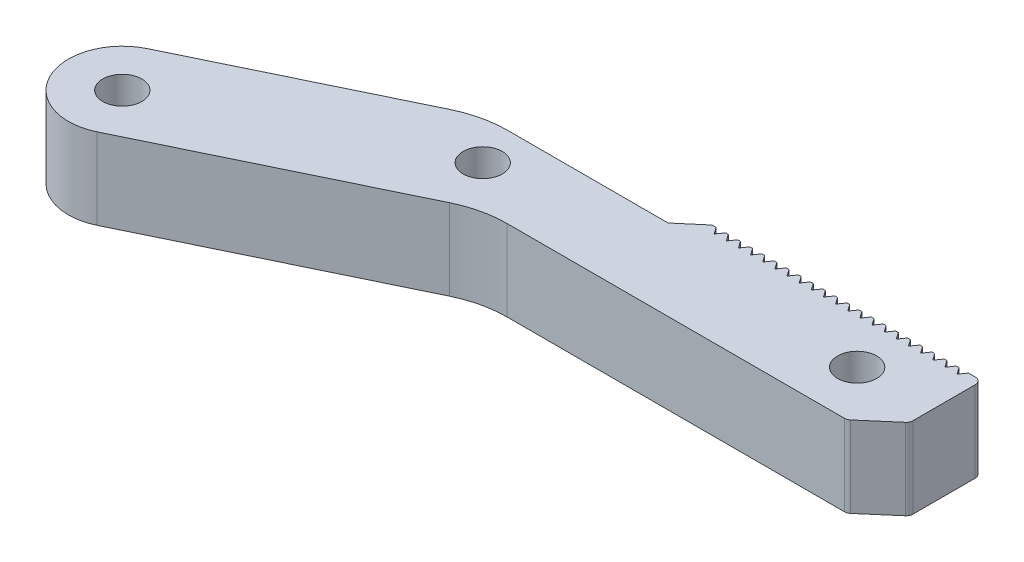
from build123d import *

# Parameters (mm, degrees)
CROQUIS1_R              = 1.45
SALIENTE_EXTRUIR1_DEPTH = 6
REDONDEO1_R             = 0.5
REDONDEO2_R             = 8


with BuildPart() as part:
    # Croquis1 → Saliente-Extruir1 (new body)
    with BuildSketch(Plane(origin=(0, 0, 0), x_dir=(1, 0, 0), z_dir=(0, 1, 0))):
        with BuildLine():
            Line((-2.262086681, -28.652334501), (24.75319, -28.652334501))
            Line((24.75319, -28.652334501), (27.25319, -26.502334501))
            Line((27.25319, -26.502334501), (27.25319, -22.652334501))
            Line((27.25319, -22.652334501), (27.25319, -21.152334501))
            Line((27.25319, -21.152334501), (26.25319, -21.152334501))
            Line((26.25319, -21.152334501), (25.90319, -21.652334501))
            Line((25.90319, -21.652334501), (25.55319, -21.152334501))
            Line((25.55319, -21.152334501), (25.35319, -21.152334501))
            Line((25.35319, -21.152334501), (25.00319, -21.652334501))
            Line((25.00319, -21.652334501), (24.65319, -21.152334501))
            Line((24.65319, -21.152334501), (24.45319, -21.152334501))
            Line((24.45319, -21.152334501), (24.10319, -21.652334501))
            Line((24.10319, -21.652334501), (23.75319, -21.152334501))
            Line((23.75319, -21.152334501), (23.55319, -21.152334501))
            Line((23.55319, -21.152334501), (23.20319, -21.652334501))
            Line((23.20319, -21.652334501), (22.85319, -21.152334501))
            Line((22.85319, -21.152334501), (22.65319, -21.152334501))
            Line((22.65319, -21.152334501), (22.30319, -21.652334501))
            Line((22.30319, -21.652334501), (21.95319, -21.152334501))
            Line((21.95319, -21.152334501), (21.75319, -21.152334501))
            Line((21.75319, -21.152334501), (21.40319, -21.652334501))
            Line((21.40319, -21.652334501), (21.05319, -21.152334501))
            Line((21.05319, -21.152334501), (20.85319, -21.152334501))
            Line((20.85319, -21.152334501), (20.50319, -21.652334501))
            Line((20.50319, -21.652334501), (20.15319, -21.152334501))
            Line((20.15319, -21.152334501), (19.95319, -21.152334501))
            Line((19.95319, -21.152334501), (19.60319, -21.652334501))
            Line((19.60319, -21.652334501), (19.25319, -21.152334501))
            Line((19.25319, -21.152334501), (19.05319, -21.152334501))
            Line((19.05319, -21.152334501), (18.70319, -21.652334501))
            Line((18.70319, -21.652334501), (18.35319, -21.152334501))
            Line((18.35319, -21.152334501), (18.15319, -21.152334501))
            Line((18.15319, -21.152334501), (17.80319, -21.652334501))
            Line((17.80319, -21.652334501), (17.45319, -21.152334501))
            Line((17.45319, -21.152334501), (17.25319, -21.152334501))
            Line((17.25319, -21.152334501), (16.90319, -21.652334501))
            Line((16.90319, -21.652334501), (16.55319, -21.152334501))
            Line((16.55319, -21.152334501), (16.35319, -21.152334501))
            Line((16.35319, -21.152334501), (16.00319, -21.652334501))
            Line((16.00319, -21.652334501), (15.65319, -21.152334501))
            Line((15.65319, -21.152334501), (15.45319, -21.152334501))
            Line((15.45319, -21.152334501), (15.10319, -21.652334501))
            Line((15.10319, -21.652334501), (14.75319, -21.152334501))
            Line((14.75319, -21.152334501), (14.55319, -21.152334501))
            Line((14.55319, -21.152334501), (14.20319, -21.652334501))
            Line((14.20319, -21.652334501), (13.85319, -21.152334501))
            Line((13.85319, -21.152334501), (13.65319, -21.152334501))
            Line((13.65319, -21.152334501), (13.30319, -21.652334501))
            Line((13.30319, -21.652334501), (12.95319, -21.152334501))
            Line((12.95319, -21.152334501), (12.75319, -21.152334501))
            Line((12.75319, -21.152334501), (12.40319, -21.652334501))
            Line((12.40319, -21.652334501), (12.05319, -21.152334501))
            Line((12.05319, -21.152334501), (11.85319, -21.152334501))
            Line((11.85319, -21.152334501), (11.50319, -21.652334501))
            Line((11.50319, -21.652334501), (11.15319, -21.152334501))
            Line((11.15319, -21.152334501), (10.95319, -21.152334501))
            Line((10.95319, -21.152334501), (10.60319, -21.652334501))
            Line((10.60319, -21.652334501), (10.25319, -21.152334501))
            Line((10.25319, -21.152334501), (10.05319, -21.152334501))
            Line((10.05319, -21.152334501), (9.70319, -21.652334501))
            Line((9.70319, -21.652334501), (9.35319, -21.152334501))
            Line((9.35319, -21.152334501), (9.15319, -21.152334501))
            Line((9.15319, -21.152334501), (8.80319, -21.652334501))
            Line((8.80319, -21.652334501), (8.45319, -21.152334501))
            Line((8.45319, -21.152334501), (8.25319, -21.152334501))
            Line((8.25319, -21.152334501), (7.90319, -21.652334501))
            Line((7.90319, -21.652334501), (7.55319, -21.152334501))
            Line((7.55319, -21.152334501), (7.35319, -21.152334501))
            Line((7.35319, -21.152334501), (7.25319, -21.152334501))
            Line((7.25319, -21.152334501), (5.49119, -22.652334501))
            Line((5.49119, -22.652334501), (-5.24681, -22.652334501))
            Line((-5.24681, -22.652334501), (-8.231533319, -22.652334501))
            Line((-8.231533319, -22.652334501), (-24.994112506, -30.755671031))
            ThreePointArc((-24.994112506, -30.755671031), (-26.854466, -36.097869537), (-21.512267494, -37.958223031))
            Line((-21.512267494, -37.958223031), (-2.262086681, -28.652334501))
        make_face()
        with Locations((-23.25319, -34.356947031)):
            Circle(CROQUIS1_R, mode=Mode.SUBTRACT)
        with Locations((-5.24681, -25.652334501)):
            Circle(CROQUIS1_R, mode=Mode.SUBTRACT)
        with Locations((21.75319, -24.902334501)):
            Circle(CROQUIS1_R, mode=Mode.SUBTRACT)
    extrude(amount=SALIENTE_EXTRUIR1_DEPTH)

    # Redondeo1
    redondeo1_edges = [part.edges().sort_by_distance(p)[0] for p in [
        (24.75319, 3, 28.652334501),
        (27.25319, 3, 26.502334501),
        (27.25319, 3, 21.152334501),
    ]]
    fillet(redondeo1_edges, radius=REDONDEO1_R)

    # Redondeo2
    redondeo2_edges = [part.edges().sort_by_distance(p)[0] for p in [
        (-2.262086681, 3, 28.652334501),
        (-8.231533319, 3, 22.652334501),
    ]]
    fillet(redondeo2_edges, radius=REDONDEO2_R)


solid = part.part
